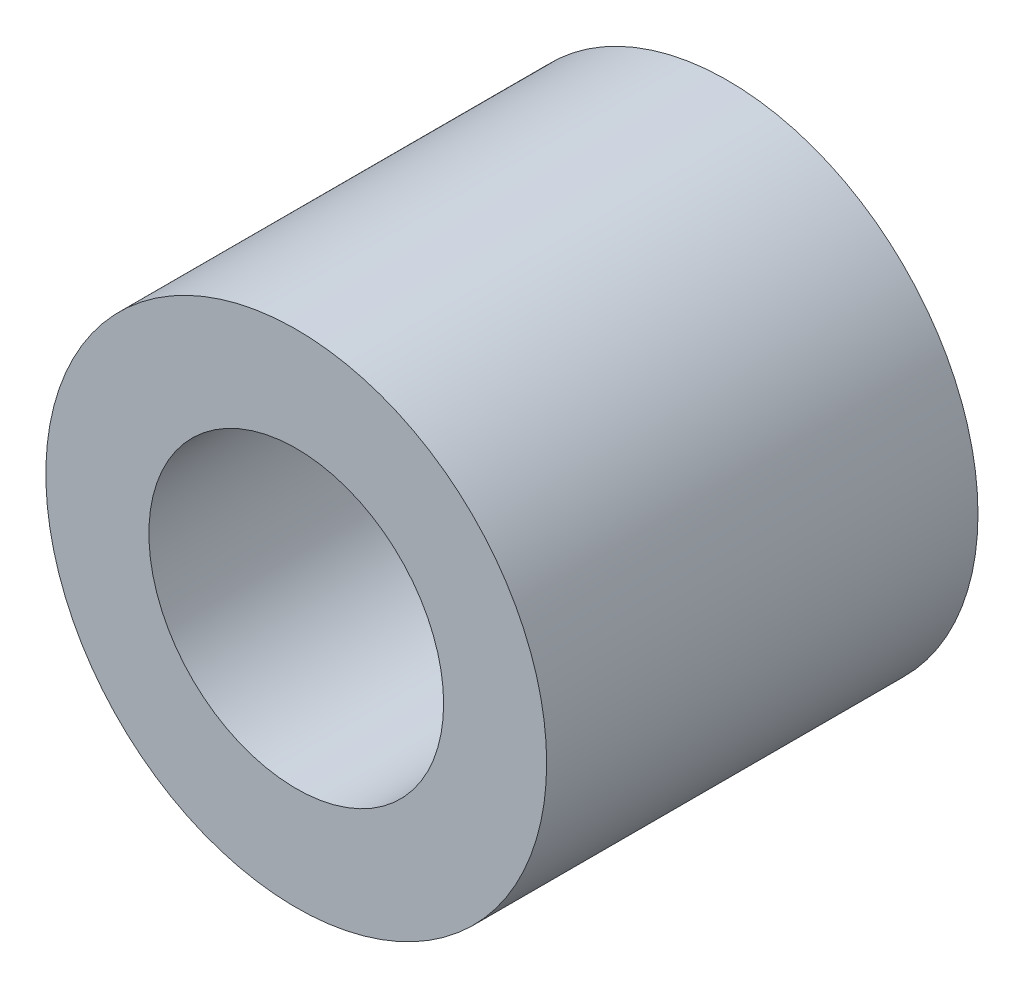
from build123d import *

# Parameters (mm, degrees)
SKETCH1_R           = 10.45
SKETCH1_R_2         = 6.15
BOSS_EXTRUDE1_DEPTH = 18


with BuildPart() as part:
    # Sketch1 → Boss-Extrude1 (new body)
    with BuildSketch(Plane.XY):
        Circle(SKETCH1_R)
        Circle(SKETCH1_R_2, mode=Mode.SUBTRACT)
    extrude(amount=BOSS_EXTRUDE1_DEPTH)


solid = part.part
